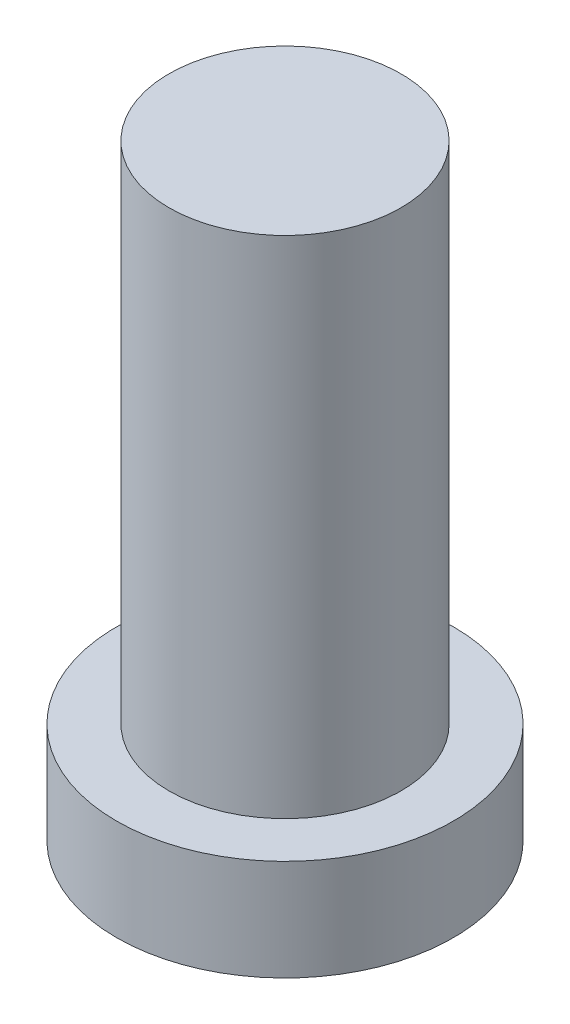
from build123d import *

# Parameters (mm, degrees)
SKETCH1_R           = 50
BOSS_EXTRUDE1_DEPTH = 30
SKETCH2_R           = 34.466040778
BOSS_EXTRUDE2_DEPTH = 150


with BuildPart() as part:
    # Sketch1 → Boss-Extrude1 (new body)
    with BuildSketch(Plane(origin=(0, 0, 0), x_dir=(1, 0, 0), z_dir=(0, 1, 0))):
        with Locations(Location((0, 0, 0), (0, 0, 270))):
            Circle(SKETCH1_R)
    extrude(amount=BOSS_EXTRUDE1_DEPTH)

    # Sketch2 → Boss-Extrude2 (add)
    with BuildSketch(Plane(origin=(0, 30, 0), x_dir=(1, 0, 0), z_dir=(0, 1, 0))):
        with Locations(Location((0, 0, 0), (0, 0, 270))):
            Circle(SKETCH2_R)
    extrude(amount=BOSS_EXTRUDE2_DEPTH)


solid = part.part
